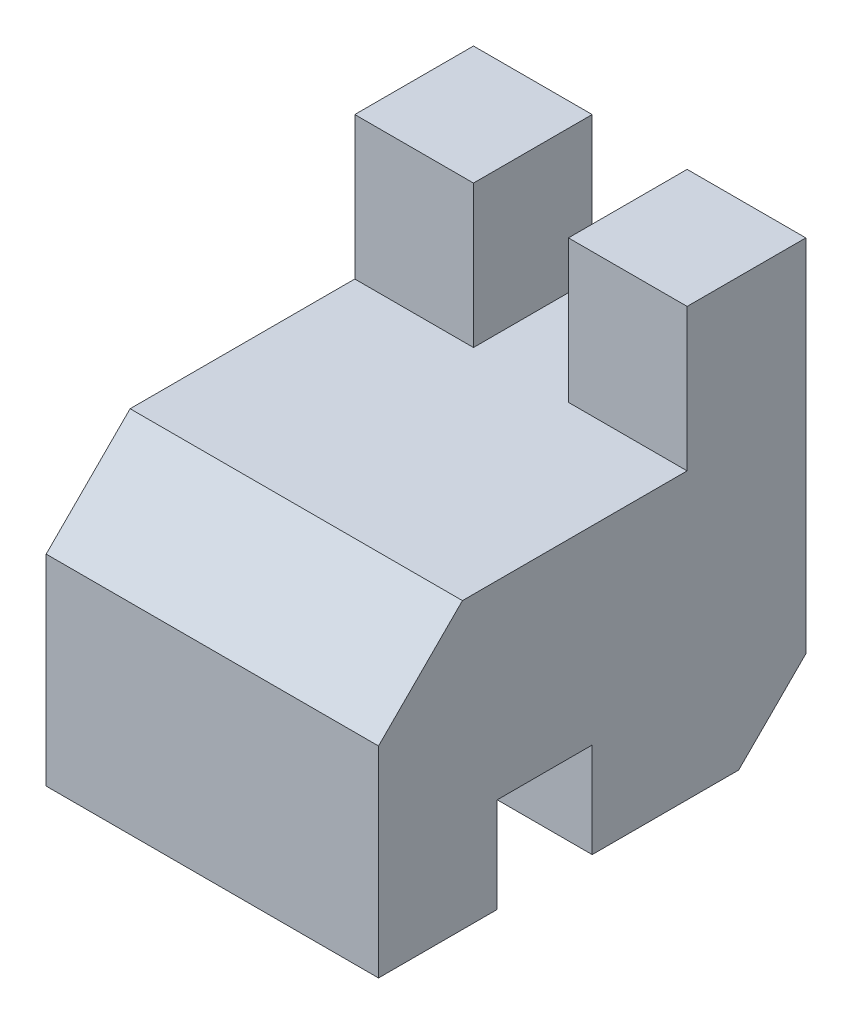
from build123d import *

# Parameters (mm, degrees)
BOSS_EXTRUDE1_DEPTH      = 35
BOSS_EXTRUDE1_DEPTH_BACK = 35
CUT_EXTRUDE1_DEPTH       = 13
CUT_EXTRUDE1_DEPTH_BACK  = 17
SKETCH2_W                = 20
SKETCH2_H                = 30


with BuildPart() as part:
    # Sketch1 → Boss-Extrude1 (new, two sides: drawn at the far end of the back side and taken through both)
    with BuildSketch(Plane(origin=(0, 0, 0), x_dir=(0, 0, -1), z_dir=(1, 0, 0)).offset(-BOSS_EXTRUDE1_DEPTH_BACK)):
        Polygon((0, 0), (-30.857864376, 0), (-30.857864376, 20), (-50.857864376, 20), (-50.857864376, 0), (-75.857864376, 0), (-75.857864376, 42.32233047), (-58.180194847, 60), (-10.857864376, 60), (-10.857864376, 90), (14.142135624, 90), (14.142135624, 14.142135624), align=None)
    extrude(amount=BOSS_EXTRUDE1_DEPTH + BOSS_EXTRUDE1_DEPTH_BACK)

    # Sketch2 → Cut-Extrude1 (cut, two sides: drawn at the far end of the back side and taken through both)
    with BuildSketch(Plane.XY.offset(-CUT_EXTRUDE1_DEPTH_BACK)):
        with Locations((0, 75)):
            Rectangle(SKETCH2_W, SKETCH2_H)
    extrude(amount=CUT_EXTRUDE1_DEPTH + CUT_EXTRUDE1_DEPTH_BACK, mode=Mode.SUBTRACT)


solid = part.part
